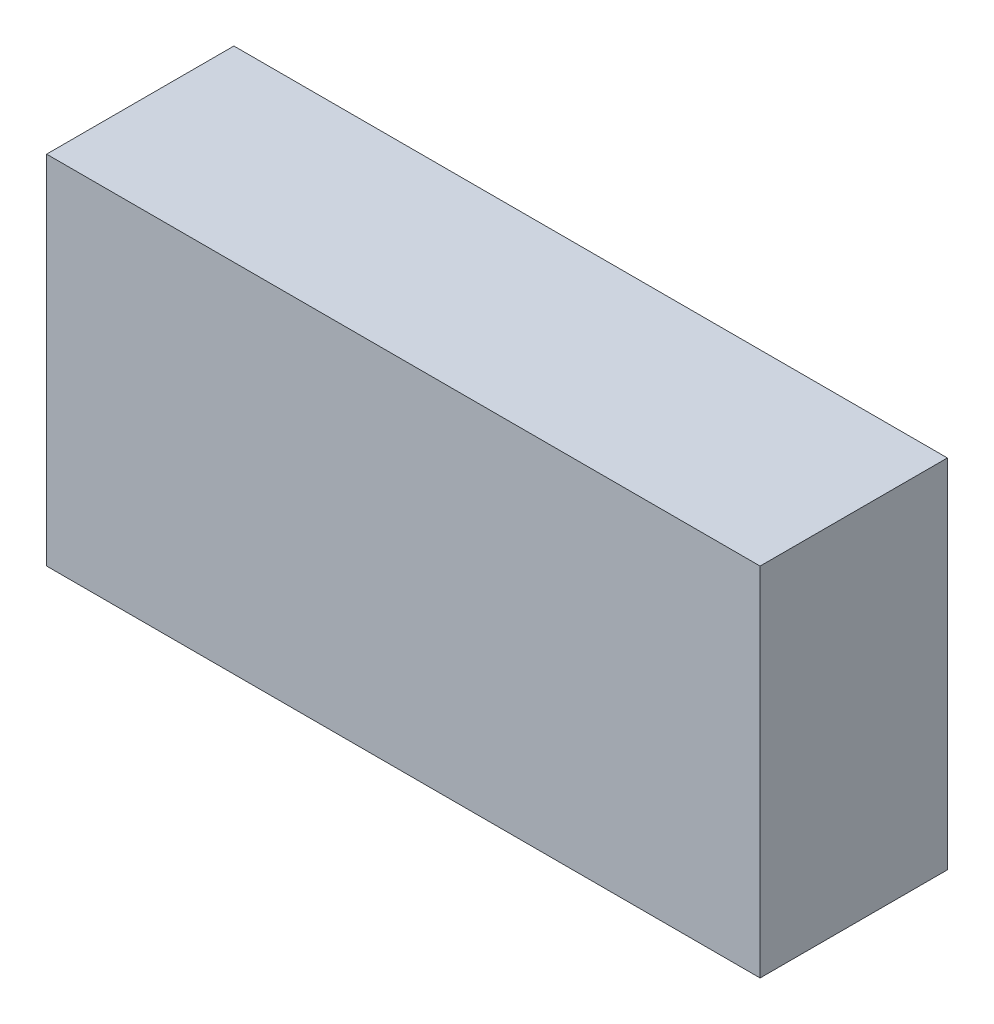
from build123d import *

# Parameters (mm, degrees)
SKETCH1_W           = 4
SKETCH1_H           = 2
BOSS_EXTRUDE1_DEPTH = 1.05


with BuildPart() as part:
    # Sketch1 → Boss-Extrude1 (new body)
    with BuildSketch(Plane.XY):
        with Locations((-23.337227498, 14.135995444)):
            Rectangle(SKETCH1_W, SKETCH1_H)
    extrude(amount=BOSS_EXTRUDE1_DEPTH)


solid = part.part
